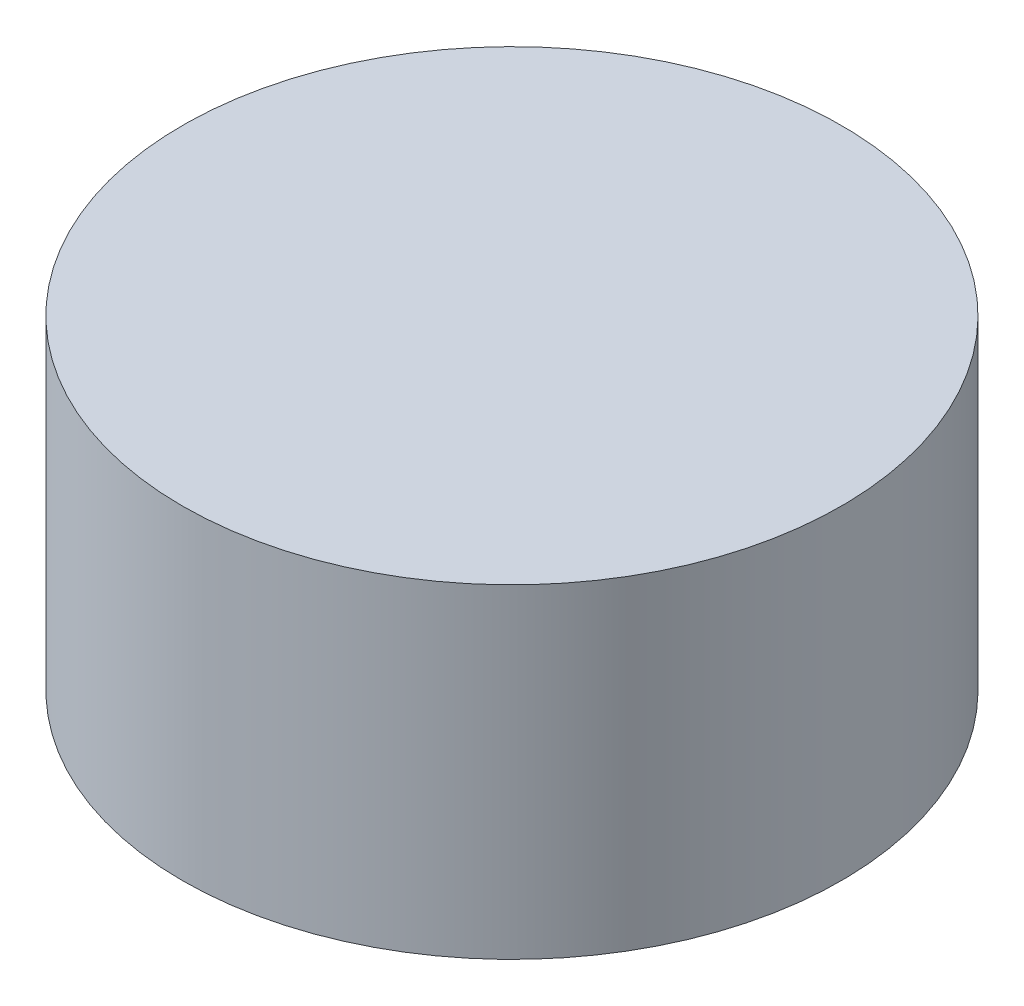
from build123d import *

# Parameters (mm, degrees)
SKETCH1_R           = 3.2
BOSS_EXTRUDE1_DEPTH = 3.15


with BuildPart() as part:
    # Sketch1 → Boss-Extrude1 (new body)
    with BuildSketch(Plane(origin=(0, 0, 0), x_dir=(1, 0, 0), z_dir=(0, 1, 0))):
        with Locations(Location((0, 0, 0), (0, 0, 270))):
            Circle(SKETCH1_R)
    extrude(amount=BOSS_EXTRUDE1_DEPTH)


solid = part.part
